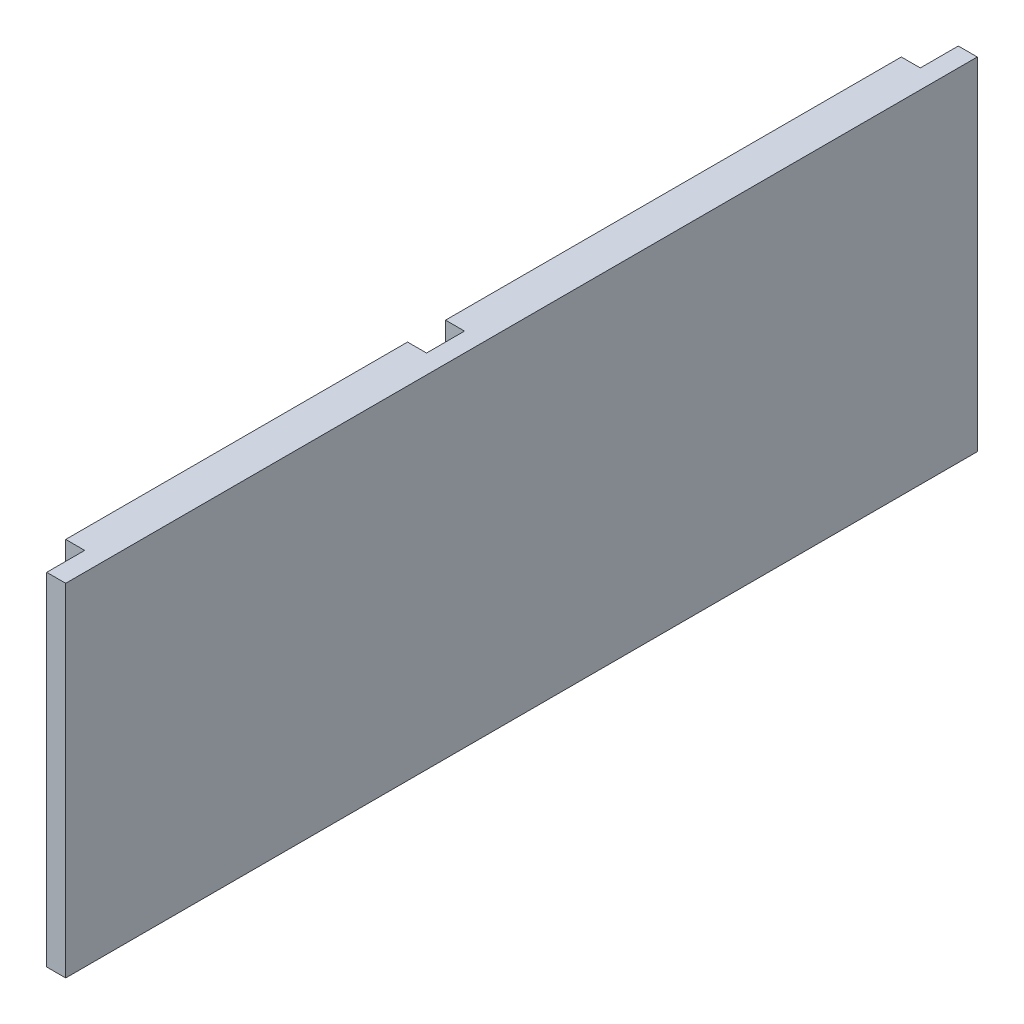
from build123d import *

# Parameters (mm, degrees)
SKETCH1_W           = 304.8
SKETCH1_H           = 114.3
BOSS_EXTRUDE1_DEPTH = 12.7
SKETCH2_W           = 12.7
SKETCH2_H           = 114.3
CUT_EXTRUDE1_DEPTH  = 6.35


with BuildPart() as part:
    # Sketch1 → Boss-Extrude1 (new body)
    with BuildSketch(Plane(origin=(0, 0, 0), x_dir=(0, 0, -1), z_dir=(1, 0, 0))):
        with Locations((152.4, 57.15)):
            Rectangle(SKETCH1_W, SKETCH1_H)
    extrude(amount=BOSS_EXTRUDE1_DEPTH)

    # Sketch2 → Cut-Extrude1 (cut)
    with BuildSketch(Plane.ZY):
        with Locations((-6.35, 57.15)):
            Rectangle(SKETCH2_W, SKETCH2_H)
        with Locations((-298.45, 57.15)):
            Rectangle(SKETCH2_W, SKETCH2_H)
        with Locations((-133.35, 57.15)):
            Rectangle(SKETCH2_W, SKETCH2_H)
    extrude(amount=-CUT_EXTRUDE1_DEPTH, mode=Mode.SUBTRACT)


solid = part.part
